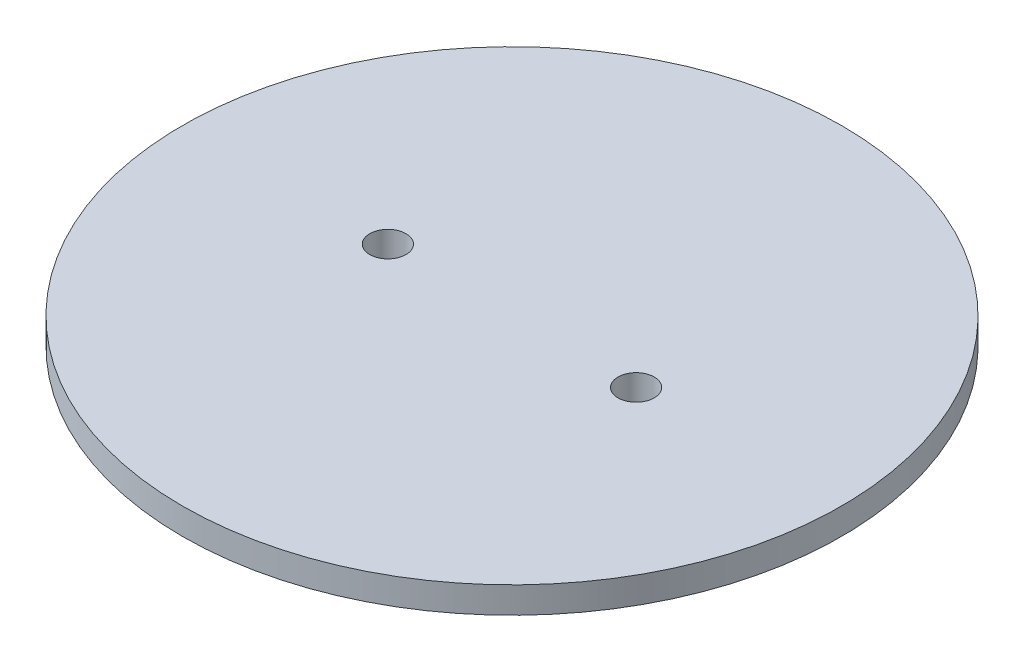
from build123d import *

# Parameters (mm, degrees)
SKETCH_1_R      = 50
SKETCH_1_R_2    = 2.75
EXTRUDE_1_DEPTH = 4


with BuildPart() as part:
    # 草圖1 → 填料-伸長1 (new body)
    with BuildSketch(Plane(origin=(0, 0, 0), x_dir=(1, 0, 0), z_dir=(0, 1, 0))):
        with Locations(Location((0, 0, 0), (0, 0, 270))):
            Circle(SKETCH_1_R)
        with Locations(Location((-18.83, 0, 0), (0, 0, 270))):
            Circle(SKETCH_1_R_2, mode=Mode.SUBTRACT)
        with Locations(Location((18.83, 0, 0), (0, 0, 270))):
            Circle(SKETCH_1_R_2, mode=Mode.SUBTRACT)
    extrude(amount=EXTRUDE_1_DEPTH)


solid = part.part
